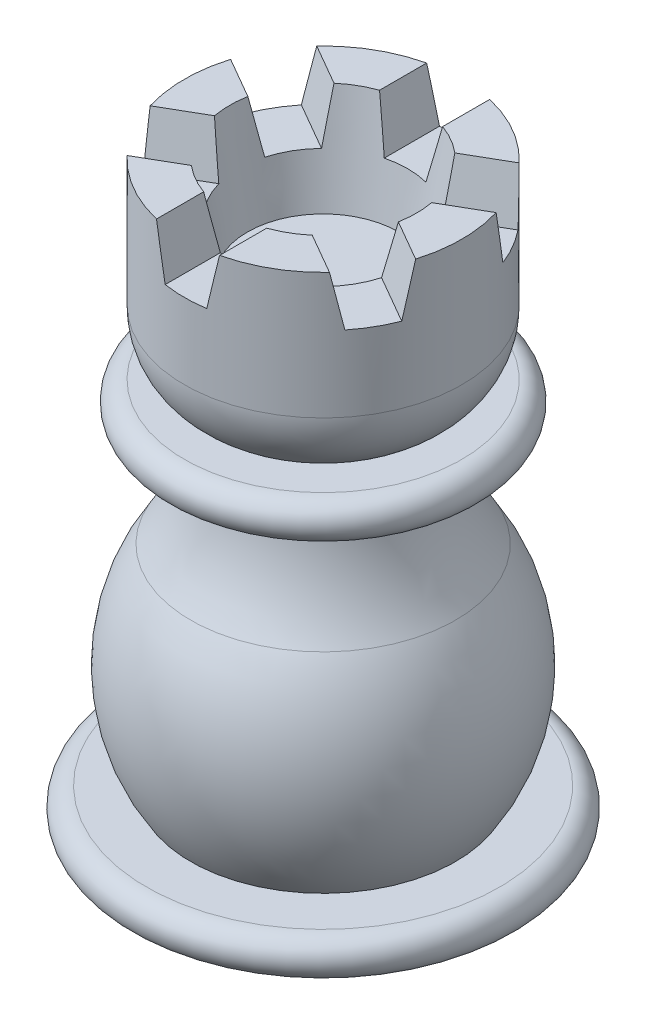
from build123d import *

# Parameters (mm, degrees)
CUT_EXTRUDE1_DEPTH = 51.955863315
CIRPATTERN1_COUNT  = 3


with BuildPart() as part:
    # Sketch1 → Revolve1 (revolve)
    with BuildSketch(Plane.XY, mode=Mode.PRIVATE) as revolve1_sk:
        with BuildLine():
            Line((0, 0), (14, 0))
            ThreePointArc((14, 0), (15.5, 1.5), (14, 3))
            Line((14, 3), (10.5, 3))
            ThreePointArc((10.5, 3), (13, 11.291561976), (10.5, 19.583123952))
            ThreePointArc((10.5, 19.583123952), (8.638593384, 23.544558909), (8, 27.874685928))
            Line((8, 27.874685928), (11, 27.874685928))
            ThreePointArc((11, 27.874685928), (12.5, 29.374685928), (11, 30.874685928))
            Line((11, 30.874685928), (8.11948003, 30.874685928))
            ThreePointArc((8.11948003, 30.874685928), (10.230529619, 33.060346975), (11, 36))
            Line((11, 36), (11, 46))
            Line((11, 46), (7.410615846, 46))
            Line((7.410615846, 46), (6, 38))
            Line((6, 38), (0, 38))
            Line((0, 38), (0, 0))
        make_face()
    revolve(revolve1_sk.sketch.rotate(Axis((0, 0, 0), (0, 1, 0)), 90), axis=Axis((0, 0, 0), (0, 1, 0)))

    # Sketch2 → Cut-Extrude1 (cut, symmetric)
    with BuildSketch(Plane.XY):
        Polygon((-25.119537303, 152.415491853), (-2.500226247, 46), (-1.65, 42), (1.649547507, 42), (2.499773753, 46), (25.11908481, 152.415491853), (25.11908481, 370.001246341), (-25.119537303, 370.001246341), align=None)
    cut_extrude1 = extrude(amount=CUT_EXTRUDE1_DEPTH, both=True, mode=Mode.SUBTRACT)

    # CirPattern1: Cut-Extrude1 ×3 about axis
    cirpattern1_axis = Axis((0, 0, 0), (0, 1, 0))
    for i in range(1, CIRPATTERN1_COUNT):
        add(cut_extrude1.rotate(cirpattern1_axis, i * 360 / CIRPATTERN1_COUNT), mode=Mode.SUBTRACT)


solid = part.part
